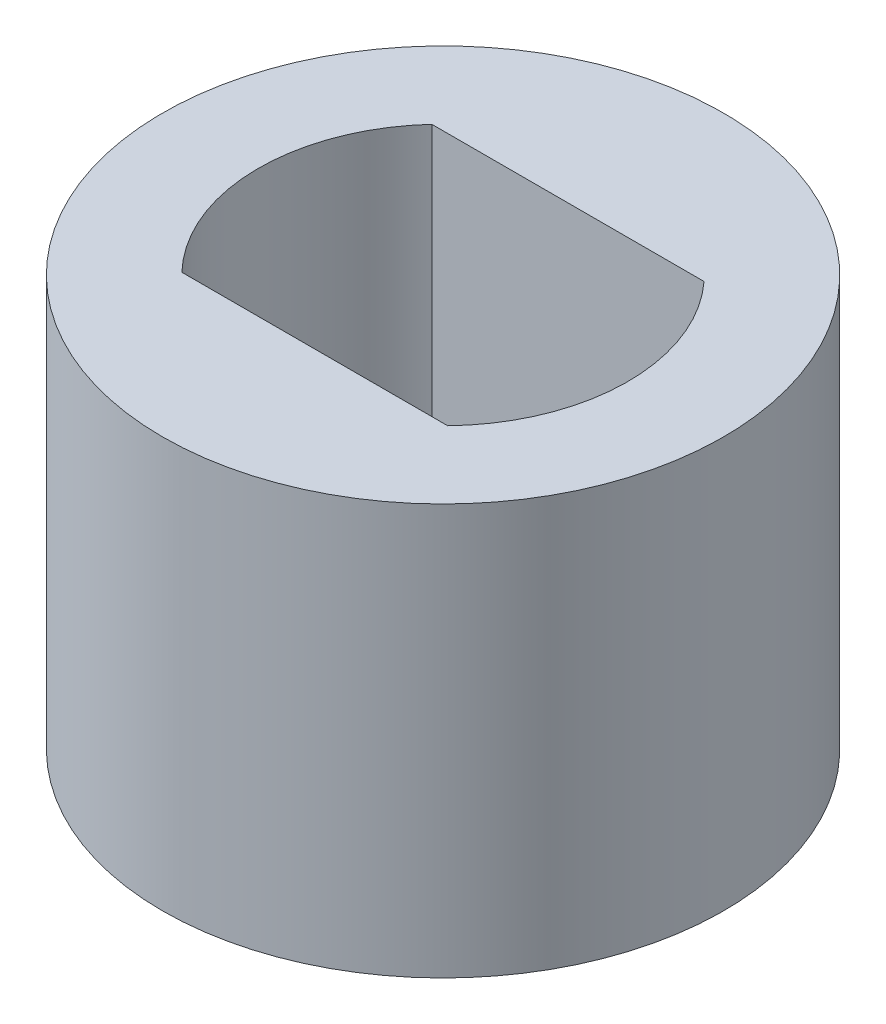
from build123d import *

# Parameters (mm, degrees)
SKETCH1_R           = 4.1
BOSS_EXTRUDE1_DEPTH = 6
CUT_EXTRUDE1_DEPTH  = 8


with BuildPart() as part:
    # Sketch1 → Boss-Extrude1 (new body)
    with BuildSketch(Plane(origin=(0, 0, 0), x_dir=(1, 0, 0), z_dir=(0, 1, 0))):
        with Locations(Location((0, 0, 0), (0, 0, 270))):
            Circle(SKETCH1_R)
    extrude(amount=BOSS_EXTRUDE1_DEPTH)

    # Sketch2 → Cut-Extrude1 (cut)
    with BuildSketch(Plane(origin=(0, 6, 0), x_dir=(1, 0, 0), z_dir=(0, 1, 0))):
        with BuildLine():
            Line((1.989817831, 1.825), (-1.989817831, 1.825))
            ThreePointArc((-1.989817831, 1.825), (-2.699781796, -0.034325722), (-1.942775077, -1.875))
            Line((-1.942775077, -1.875), (1.942775077, -1.875))
            ThreePointArc((1.942775077, -1.875), (2.699781796, -0.034325722), (1.989817831, 1.825))
        make_face()
    extrude(amount=-CUT_EXTRUDE1_DEPTH, mode=Mode.SUBTRACT)


solid = part.part
